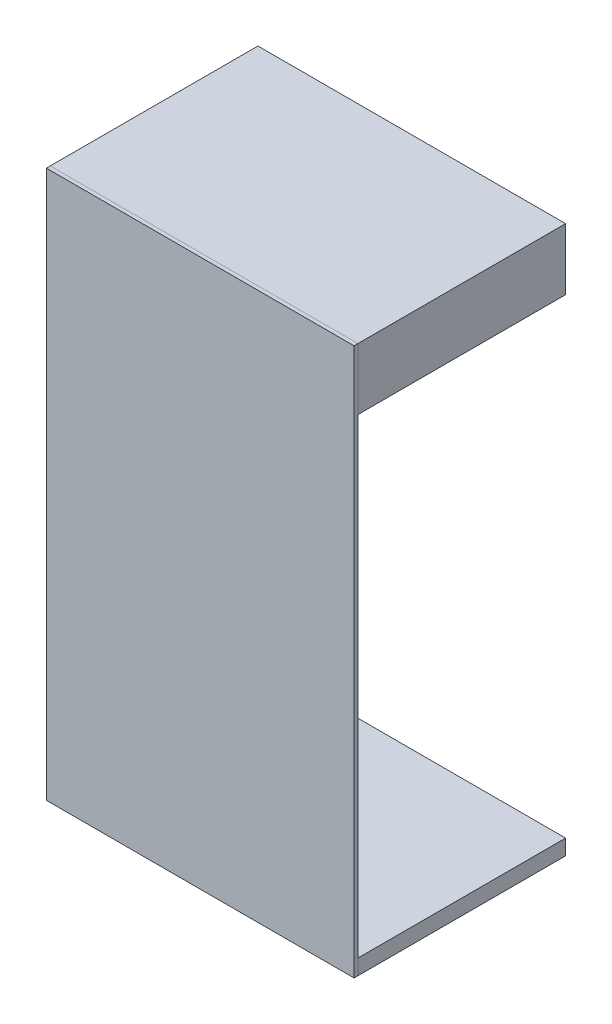
from build123d import *

# Parameters (mm, degrees)
SKETCH_1_W      = 4000
SKETCH_1_H      = 7118
EXTRUDE_1_DEPTH = 50
EXTRUDE_2_DEPTH = 2700


with BuildPart() as part:
    # Эскиз1 → Бобышка-Вытянуть1 (new body)
    with BuildSketch(Plane.XY):
        with Locations((-10127, -3559)):
            Rectangle(SKETCH_1_W, SKETCH_1_H)
    extrude(amount=-EXTRUDE_1_DEPTH)


with BuildPart() as body_2:
    # Эскиз2 → Бобышка-Вытянуть2 (new body)
    with BuildSketch(Plane(origin=(0, 0, -50), x_dir=(-1, 0, 0), z_dir=(0, 0, -1))):
        Polygon((8127, -800), (8127, 0), (12127, 0), (12127, -7118), (8127, -7118), (8127, -6918), (11927, -6918), (11927, -200), (8327, -200), (8327, -800), align=None)
    extrude(amount=EXTRUDE_2_DEPTH)


solid = Compound([part.part, body_2.part])
